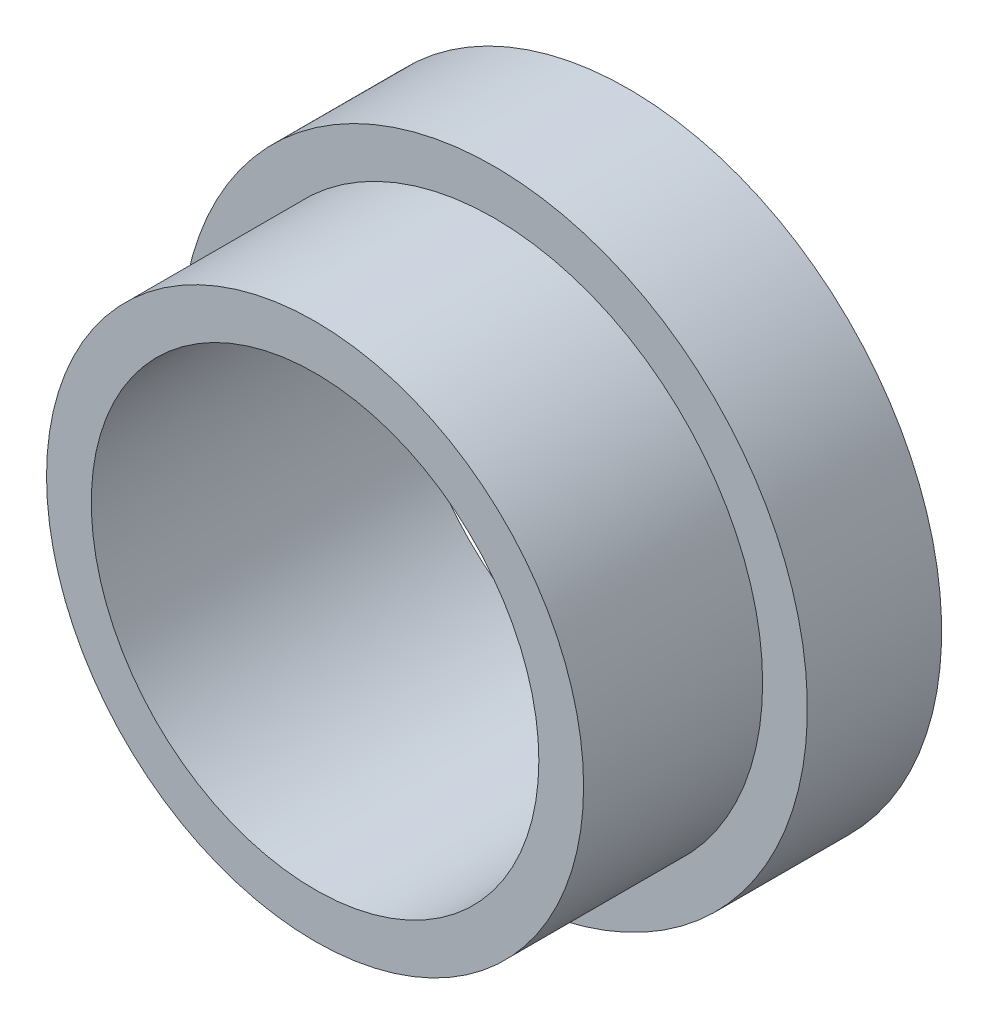
from build123d import *

# Parameters (mm, degrees)
SKETCH_1_R      = 6
SKETCH_1_R_2    = 5
EXTRUDE_1_DEPTH = 7
SKETCH_2_R      = 7
SKETCH_2_R_2    = 6
EXTRUDE_2_DEPTH = 3


with BuildPart() as part:
    # 草图1 → 凸台-拉伸1 (new body)
    with BuildSketch(Plane.XY):
        Circle(SKETCH_1_R)
        Circle(SKETCH_1_R_2, mode=Mode.SUBTRACT)
    extrude(amount=EXTRUDE_1_DEPTH)

    # 草图2 → 凸台-拉伸2 (add)
    with BuildSketch(Plane(origin=(0, 0, 0), x_dir=(-1, 0, 0), z_dir=(0, 0, -1))):
        Circle(SKETCH_2_R)
        Circle(SKETCH_2_R_2, mode=Mode.SUBTRACT)
    extrude(amount=-EXTRUDE_2_DEPTH)


solid = part.part
